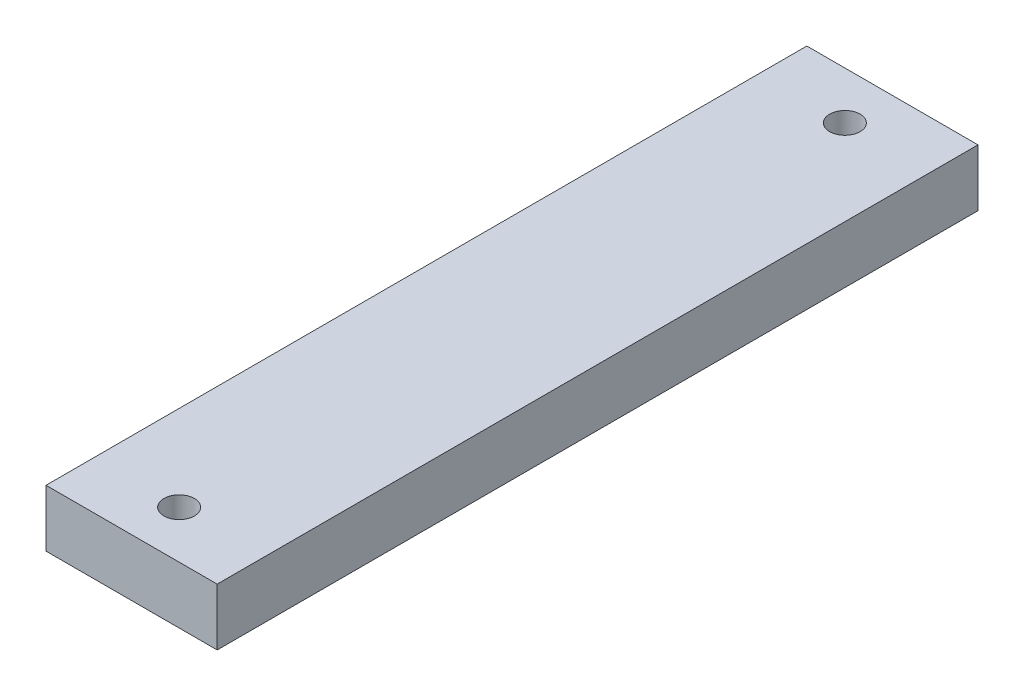
from build123d import *

# Parameters (mm, degrees)
SKETCH1_W           = 18
SKETCH1_H           = 80
SKETCH1_R           = 1.6
BOSS_EXTRUDE1_DEPTH = 6


with BuildPart() as part:
    # Sketch1 → Boss-Extrude1 (new body)
    with BuildSketch(Plane(origin=(0, 0, 0), x_dir=(1, 0, 0), z_dir=(0, 1, 0))):
        Rectangle(SKETCH1_W, SKETCH1_H)
        with Locations(Location((0, -35, 0), (0, 0, 270))):
            Circle(SKETCH1_R, mode=Mode.SUBTRACT)
        with Locations(Location((0, 35, 0), (0, 0, 90))):
            Circle(SKETCH1_R, mode=Mode.SUBTRACT)
    extrude(amount=BOSS_EXTRUDE1_DEPTH)


solid = part.part
